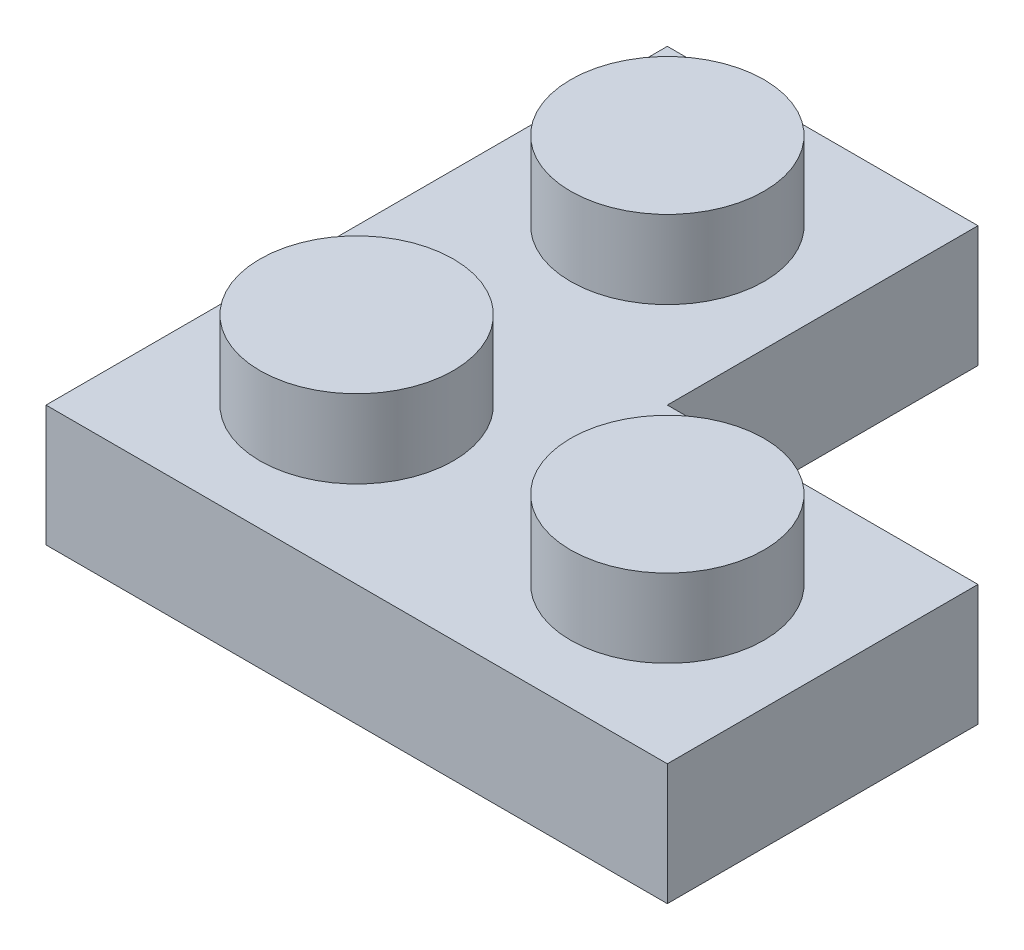
from build123d import *

# Parameters (mm, degrees)
BOSS_EXTRUDE1_DEPTH = 3.1
SKETCH2_R           = 2.475
BOSS_EXTRUDE2_DEPTH = 2
CUT_EXTRUDE1_DEPTH  = 2


with BuildPart() as part:
    # Sketch1 → Boss-Extrude1 (new body)
    with BuildSketch(Plane(origin=(0, 0, 0), x_dir=(1, 0, 0), z_dir=(0, 1, 0))):
        Polygon((0, 0), (7.95, 0), (7.95, -7.95), (15.9, -7.95), (15.9, -15.9), (0, -15.9), align=None)
    extrude(amount=BOSS_EXTRUDE1_DEPTH)

    # Sketch2 → Boss-Extrude2 (add)
    with BuildSketch(Plane(origin=(0, 3.1, 0), x_dir=(1, 0, 0), z_dir=(0, 1, 0))):
        with Locations(Location((3.975, -3.975, 0), (0, 0, 270))):
            Circle(SKETCH2_R)
        with Locations(Location((3.975, -11.925, 0), (0, 0, 270))):
            Circle(SKETCH2_R)
        with Locations(Location((11.925, -11.925, 0), (0, 0, 270))):
            Circle(SKETCH2_R)
    extrude(amount=BOSS_EXTRUDE2_DEPTH)

    # Sketch3 → Cut-Extrude1 (cut)
    with BuildSketch(Plane.XZ):
        Polygon((1.5, 14.4), (1.5, 1.5), (6.45, 1.5), (6.45, 9.45), (14.4, 9.45), (14.4, 14.4), align=None)
    extrude(amount=-CUT_EXTRUDE1_DEPTH, mode=Mode.SUBTRACT)


solid = part.part
